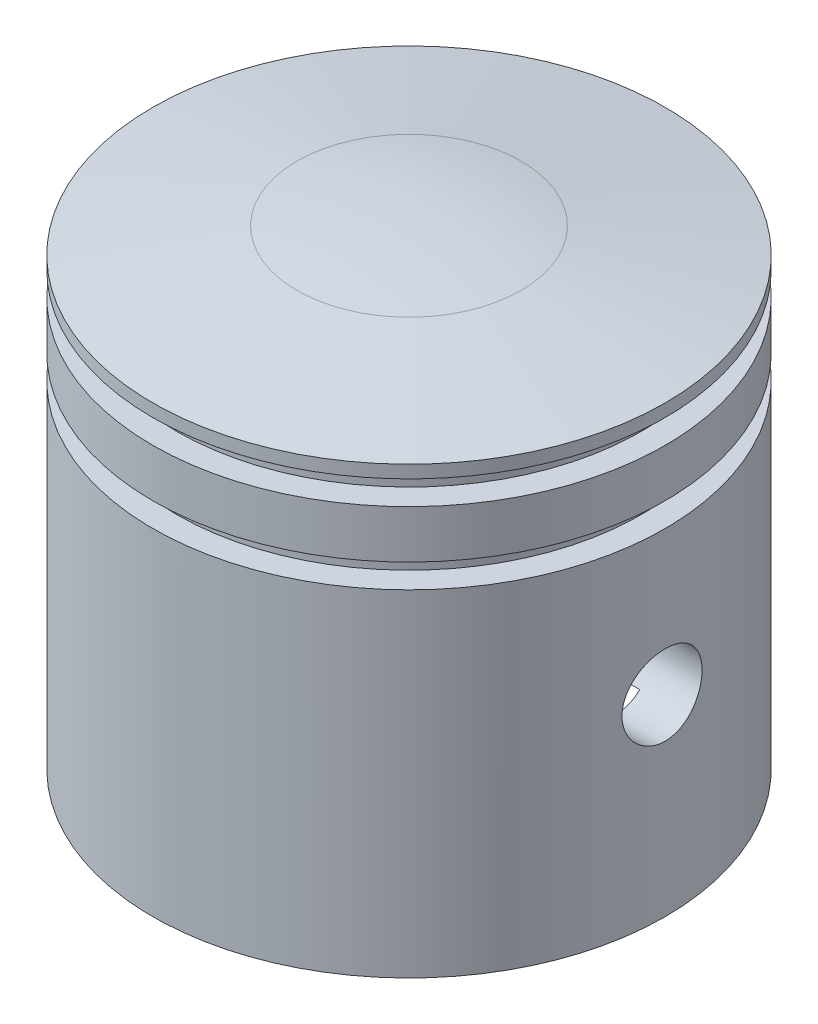
from build123d import *

# Parameters (mm, degrees)
SKETCH2_W               = 3.590975848
SKETCH2_H               = 1.5
SKETCH2_W_2             = 2.734034887
SKETCH3_R               = 10
CUT_EXTRUDE1_DEPTH      = 24
SKETCH4_R               = 13
CUT_EXTRUDE2_DEPTH      = 10
CUT_EXTRUDE3_DEPTH      = 38.576588456
CUT_EXTRUDE3_DEPTH_BACK = 38.576588456
SKETCH5_R               = 2.5


with BuildPart() as part:
    # Sketch1 → Revolve1 (revolve)
    with BuildSketch(Plane.XY, mode=Mode.PRIVATE) as revolve1_sk:
        with BuildLine():
            Line((0, 0), (16, 0))
            Line((16, 0), (16, 27.795794509))
            Line((16, 27.795794509), (7, 29.382737335))
            ThreePointArc((7, 29.382737335), (3.513581264, 29.845385513), (0, 30))
            Line((0, 30), (0, 0))
        make_face()
    revolve(revolve1_sk.sketch.rotate(Axis((0, 30, 0), (0, -1, 0)), 180), axis=Axis((0, 30, 0), (0, -1, 0)))

    # Sketch2 → Cut-Revolve1 (revolve, cut)
    with BuildSketch(Plane.XY, mode=Mode.PRIVATE) as cut_revolve1_sk:
        with Locations((16.295487924, 26.25)):
            Rectangle(SKETCH2_W, SKETCH2_H)
        with Locations((15.867017443, 21.75)):
            Rectangle(SKETCH2_W_2, SKETCH2_H)
    revolve(cut_revolve1_sk.sketch.rotate(Axis((0, 0, 0), (0, 1, 0)), 90), axis=Axis((0, 0, 0), (0, 1, 0)), mode=Mode.SUBTRACT)

    # Sketch3 → Cut-Extrude1 (cut)
    with BuildSketch(Plane.XZ):
        Circle(SKETCH3_R)
    extrude(amount=-CUT_EXTRUDE1_DEPTH, mode=Mode.SUBTRACT)

    # Sketch4 → Cut-Extrude2 (cut)
    with BuildSketch(Plane(origin=(0, 0, 0), x_dir=(-1, 0, 0), z_dir=(0, -1, 0))):
        with Locations(Location((0, 0, 0), (0, 0, 180))):
            Circle(SKETCH4_R)
    extrude(amount=-CUT_EXTRUDE2_DEPTH, mode=Mode.SUBTRACT)

    # Sketch5 → Cut-Extrude3 (cut, two sides: drawn at the far end of the back side and taken through both)
    with BuildSketch(Plane(origin=(0, 0, 0), x_dir=(0, 0, -1), z_dir=(1, 0, 0)).offset(-CUT_EXTRUDE3_DEPTH_BACK)):
        with Locations(Location((0, 12, 0), (0, 0, 306.869897646))):
            Circle(SKETCH5_R)
    extrude(amount=CUT_EXTRUDE3_DEPTH + CUT_EXTRUDE3_DEPTH_BACK, mode=Mode.SUBTRACT)


solid = part.part
